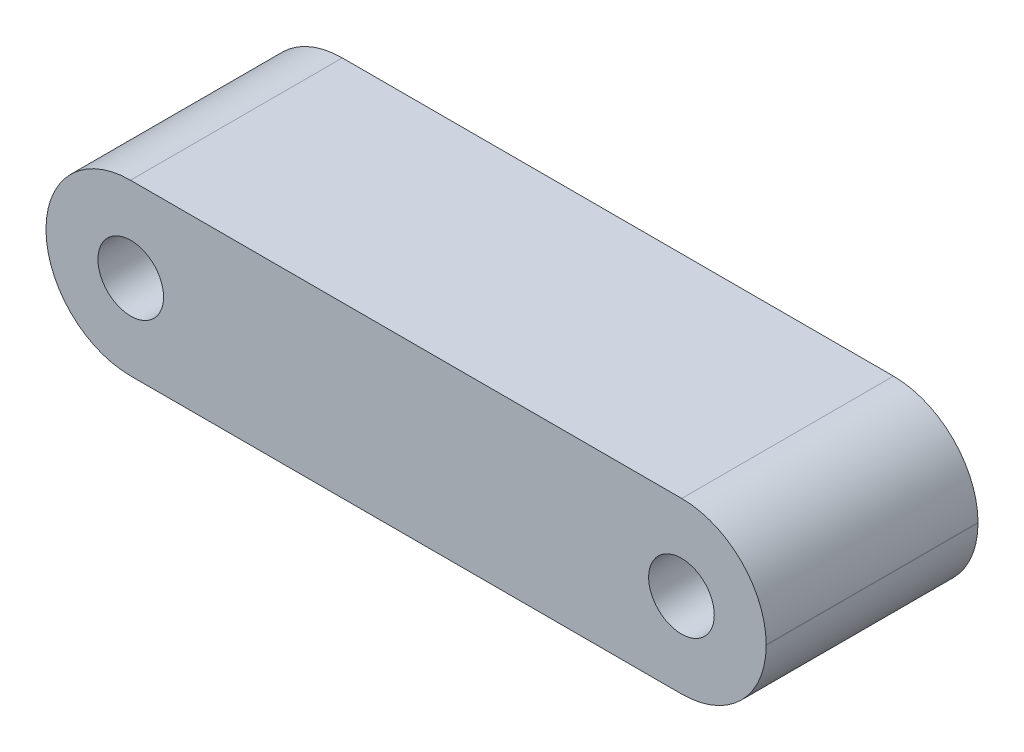
from build123d import *

# Parameters (mm, degrees)
DODANIE_WYCI_GNI_CIE1_DEPTH = 10
SZKIC2_R                    = 1.55
WYTNIJ_WYCI_GNI_CIE1_DEPTH  = 10


with BuildPart() as part:
    # Szkic1 → Dodanie-wyciągnięcie1 (new body)
    with BuildSketch(Plane.XY):
        with BuildLine():
            Line((152.31, 101.184311715), (126.29, 101.184311715))
            ThreePointArc((126.29, 101.184311715), (123.468643943, 100.015667772), (122.3, 97.194311715))
            Line((122.3, 97.194311715), (122.3, 97.174311715))
            ThreePointArc((122.3, 97.174311715), (123.468643943, 94.352955658), (126.29, 93.184311715))
            Line((126.29, 93.184311715), (152.31, 93.184311715))
            ThreePointArc((152.31, 93.184311715), (155.131356057, 94.352955658), (156.3, 97.174311715))
            Line((156.3, 97.174311715), (156.3, 97.194311715))
            ThreePointArc((156.3, 97.194311715), (155.131356057, 100.015667772), (152.31, 101.184311715))
        make_face()
    extrude(amount=DODANIE_WYCI_GNI_CIE1_DEPTH)

    # Szkic2 → Wytnij-wyciągnięcie1 (cut)
    with BuildSketch(Plane.XY.offset(10)):
        with Locations((152.3, 97.184311715)):
            Circle(SZKIC2_R)
        with Locations((126.3, 97.184311715)):
            Circle(SZKIC2_R)
    extrude(amount=-WYTNIJ_WYCI_GNI_CIE1_DEPTH, mode=Mode.SUBTRACT)


solid = part.part
